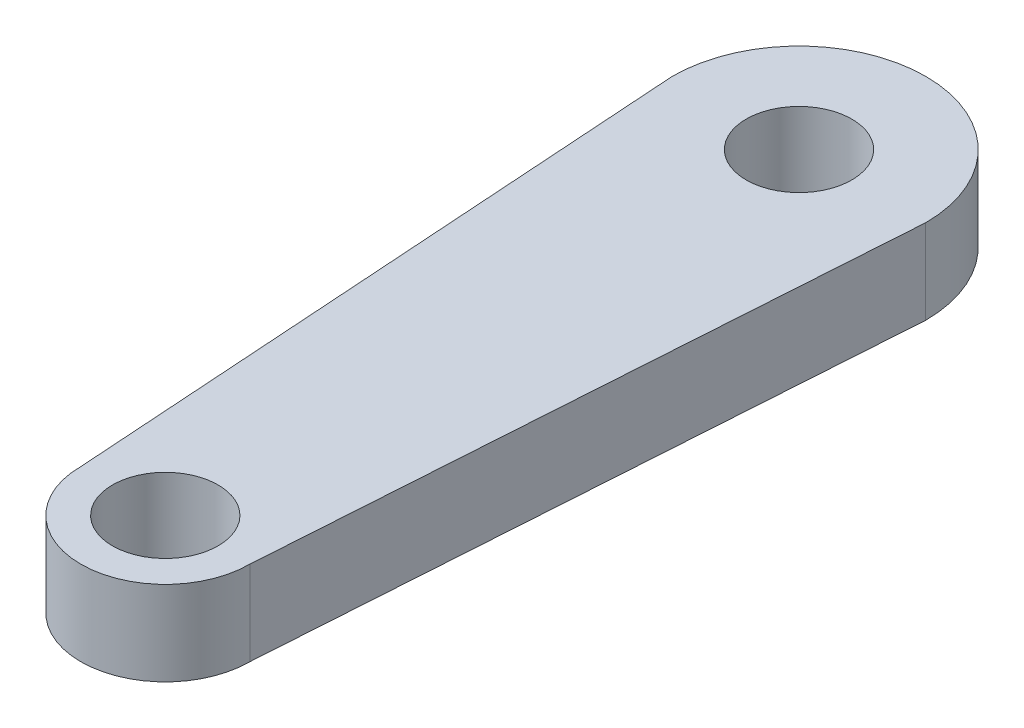
from build123d import *

# Parameters (mm, degrees)
SKETCH1_R           = 1.25
BOSS_EXTRUDE1_DEPTH = 1


with BuildPart() as part:
    # Sketch1 → Boss-Extrude1 (new, symmetric)
    with BuildSketch(Plane(origin=(0, 0, 0), x_dir=(1, 0, 0), z_dir=(0, 1, 0))):
        with BuildLine():
            ThreePointArc((3, 5), (0, 8), (-3, 5))
            Line((-3, 5), (-2.973451327, 4.601769912))
            Line((-2.973451327, 4.601769912), (-2, -10))
            ThreePointArc((-2, -10), (0, -12), (2, -10))
            Line((2, -10), (2.973451327, 4.601769912))
            Line((2.973451327, 4.601769912), (3, 5))
        make_face()
        with Locations(Location((0, -10, 0), (0, 0, 270))):
            Circle(SKETCH1_R, mode=Mode.SUBTRACT)
        with Locations(Location((0, 5, 0), (0, 0, 270))):
            Circle(SKETCH1_R, mode=Mode.SUBTRACT)
    extrude(amount=BOSS_EXTRUDE1_DEPTH, both=True)


solid = part.part
